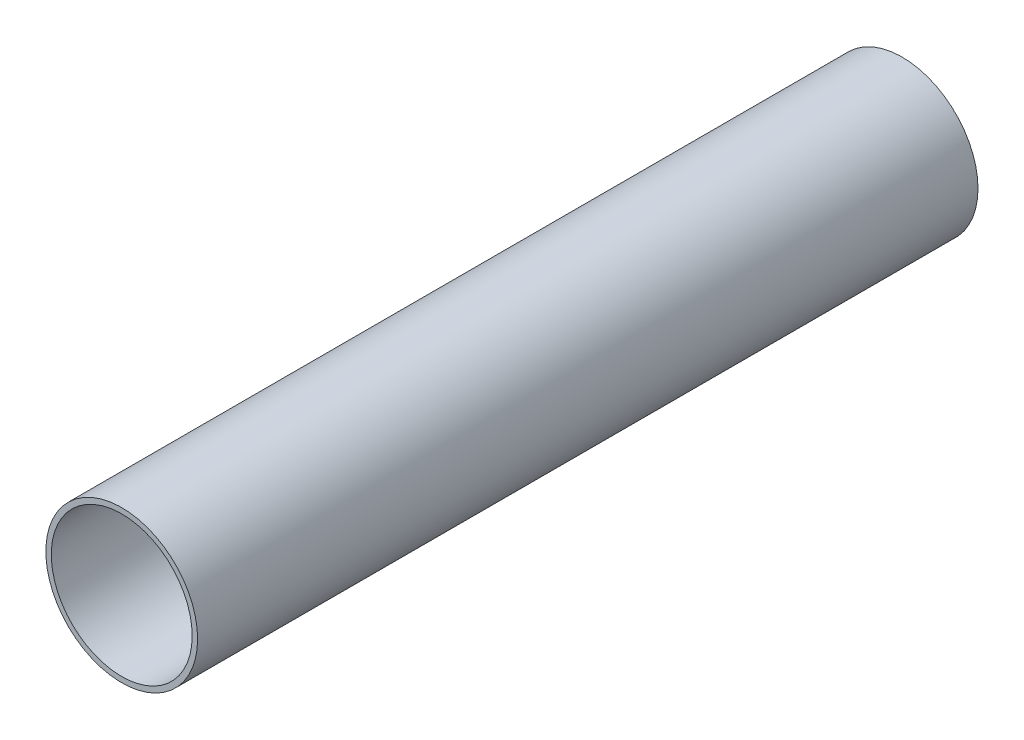
from build123d import *

# Parameters (mm, degrees)
SKETCH1_R           = 88.9
SKETCH1_R_2         = 82.55
BOSS_EXTRUDE1_DEPTH = 914.4


with BuildPart() as part:
    # Sketch1 → Boss-Extrude1 (new body)
    with BuildSketch(Plane.XY):
        Circle(SKETCH1_R)
        Circle(SKETCH1_R_2, mode=Mode.SUBTRACT)
    extrude(amount=BOSS_EXTRUDE1_DEPTH)


solid = part.part
